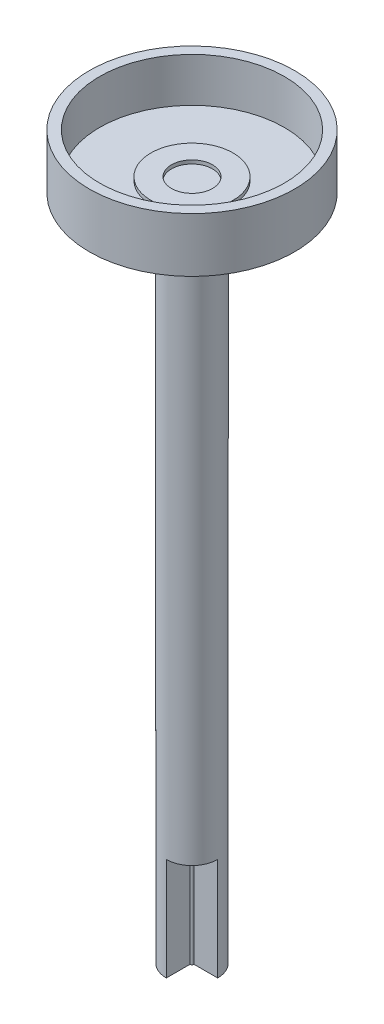
from build123d import *

# Parameters (mm, degrees)
SKETCH1_R           = 10
SKETCH1_R_2         = 9
BOSS_EXTRUDE1_DEPTH = 4.3
BOSS_EXTRUDE2_START = -1
SKETCH1_2_R         = 10
BOSS_EXTRUDE2_DEPTH = 1
SKETCH2_R           = 4
SKETCH2_R_2         = 2
EXTRUDE_THIN1_DEPTH = 0.35
SKETCH3_R           = 2.5
BOSS_EXTRUDE3_DEPTH = 65
CUT_EXTRUDE1_START  = -10
CUT_EXTRUDE1_DEPTH  = 10


with BuildPart() as part:
    # Sketch1 → Boss-Extrude1 (new body)
    with BuildSketch(Plane(origin=(0, 0, 0), x_dir=(1, 0, 0), z_dir=(0, 1, 0))):
        Circle(SKETCH1_R)
        Circle(SKETCH1_R_2, mode=Mode.SUBTRACT)
    extrude(amount=BOSS_EXTRUDE1_DEPTH)

    # Sketch1<2> → Boss-Extrude2 (add)
    with BuildSketch(Plane(origin=(0, 0, 0), x_dir=(1, 0, 0), z_dir=(0, 1, 0)).offset(BOSS_EXTRUDE2_START)):
        Circle(SKETCH1_2_R)
    extrude(amount=BOSS_EXTRUDE2_DEPTH)

    # Sketch2 → Extrude-Thin1 (add)
    with BuildSketch(Plane(origin=(0, 0, 0), x_dir=(1, 0, 0), z_dir=(0, 1, 0))):
        Circle(SKETCH2_R)
        Circle(SKETCH2_R_2, mode=Mode.SUBTRACT)
    extrude(amount=EXTRUDE_THIN1_DEPTH)

    # Sketch3 → Boss-Extrude3 (add)
    with BuildSketch(Plane.XZ.offset(1)):
        Circle(SKETCH3_R)
    extrude(amount=BOSS_EXTRUDE3_DEPTH)

    # Sketch4 → Cut-Extrude1 (cut)
    with BuildSketch(Plane.XZ.offset(66).offset(CUT_EXTRUDE1_START)):
        with BuildLine():
            Line((-2.5, 0), (-0.194982329, 0))
            ThreePointArc((-0.194982329, 0), (-0.137873327, -0.137873327), (0, -0.194982329))
            Line((0, -0.194982329), (0, -2.5))
            ThreePointArc((0, -2.5), (-1.767766953, -1.767766953), (-2.5, 0))
        make_face()
        with BuildLine():
            Line((0, 2.5), (0, 0.194982329))
            ThreePointArc((0, 0.194982329), (0.137873327, 0.137873327), (0.194982329, 0))
            Line((0.194982329, 0), (2.5, 0))
            ThreePointArc((2.5, 0), (1.767766953, 1.767766953), (0, 2.5))
        make_face()
    extrude(amount=CUT_EXTRUDE1_DEPTH, mode=Mode.SUBTRACT)


solid = part.part
